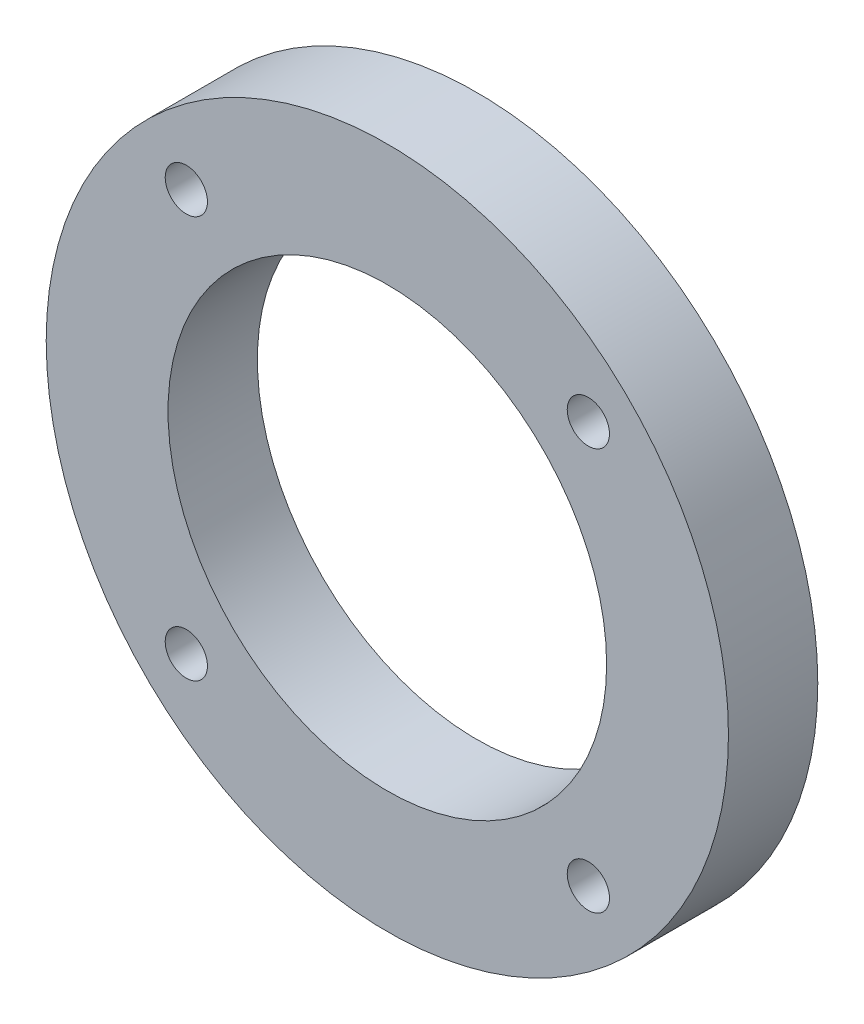
from build123d import *

# Parameters (mm, degrees)
SKETCH_1_R          = 21
SKETCH_1_R_2        = 13.5
EXTRUDE_1_DEPTH     = 5.5
SKETCH_2_R          = 1.3
CUT_EXTRUDE_1_DEPTH = 8


with BuildPart() as part:
    # 草图1 → 凸台-拉伸1 (new body)
    with BuildSketch(Plane.XY):
        Circle(SKETCH_1_R)
        Circle(SKETCH_1_R_2, mode=Mode.SUBTRACT)
    extrude(amount=EXTRUDE_1_DEPTH)

    # 草图2 → 切除-拉伸1 (cut)
    with BuildSketch(Plane(origin=(0, 0, 0), x_dir=(-1, 0, 0), z_dir=(0, 0, -1))):
        with Locations((-12.374368671, 12.374368671)):
            Circle(SKETCH_2_R)
        with Locations((12.374368671, 12.374368671)):
            Circle(SKETCH_2_R)
        with Locations((12.374368671, -12.374368671)):
            Circle(SKETCH_2_R)
        with Locations((-12.374368671, -12.374368671)):
            Circle(SKETCH_2_R)
    extrude(amount=-CUT_EXTRUDE_1_DEPTH, mode=Mode.SUBTRACT)


solid = part.part
